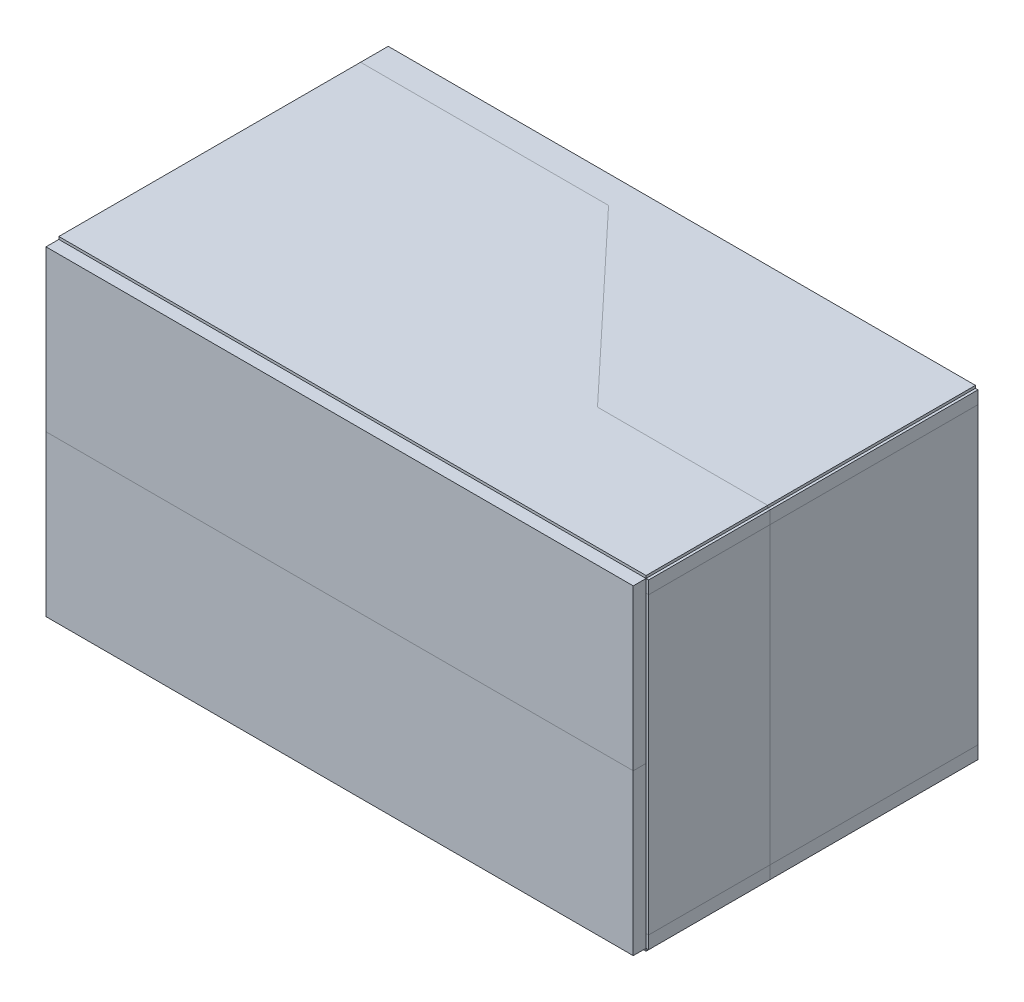
from build123d import *

# Parameters (mm, degrees)
SKETCH_1_W          = 229
SKETCH_1_H          = 124.895981316
EXTRUDE_1_DEPTH     = 7.860636733
SKETCH_2_W          = 229
SKETCH_2_H          = 5
CUT_EXTRUDE_1_DEPTH = 7.860636733
SKETCH_4_W          = 229
SKETCH_4_H          = 5
CUT_EXTRUDE_2_DEPTH = 7.860636733
SKETCH_5_W          = 5
SKETCH_5_H          = 114.895981316
CUT_EXTRUDE_3_DEPTH = 7.860636733
SKETCH_6_W          = 229
SKETCH_6_H          = 128.442125646
EXTRUDE_3_DEPTH     = 5
SKETCH_7_W          = 5
SKETCH_7_H          = 114.895981316
EXTRUDE_4_DEPTH     = 120.581488912
SKETCH_8_W          = 229
SKETCH_8_H          = 128.442125646
EXTRUDE_5_DEPTH     = 5
SKETCH_9_W          = 229
SKETCH_9_H          = 62.45
EXTRUDE_6_DEPTH     = 5
SKETCH_10_W         = 229
SKETCH_10_H         = 62.445981316
EXTRUDE_7_DEPTH     = 5
SKETCH_11_W         = 128.442125646
SKETCH_11_H         = 114.895981316
EXTRUDE_8_DEPTH     = 5
EXTRUDE_9_DEPTH     = 1
EXTRUDE_10_DEPTH    = 1
SKETCH_14_W         = 47.406489423
SKETCH_14_H         = 5
EXTRUDE_11_DEPTH    = 1
SKETCH_15_W         = 81.035636223
SKETCH_15_H         = 5
EXTRUDE_12_DEPTH    = 1
SKETCH_16_W         = 47.406489423
SKETCH_16_H         = 114.895981316
EXTRUDE_13_DEPTH    = 1
SKETCH_17_W         = 81.035636223
SKETCH_17_H         = 114.895981316
EXTRUDE_14_DEPTH    = 1
SKETCH_18_W         = 53.126978482
SKETCH_18_H         = 23.043618666
EXTRUDE_15_DEPTH    = 20
SKETCH_18_W_2       = 40.390239825
EXTRUDE_15_2_DEPTH  = 20
SKETCH_18_W_3       = 34.059537502
EXTRUDE_15_3_DEPTH  = 20
SKETCH_18_W_4       = 41.132707469
EXTRUDE_15_4_DEPTH  = 20
SKETCH_18_W_5       = 34.565287386
SKETCH_18_H_2       = 26.831202025
EXTRUDE_15_5_DEPTH  = 20
SKETCH_18_W_6       = 31.183641042
EXTRUDE_15_6_DEPTH  = 20
SKETCH_18_W_7       = 48.408890379
SKETCH_18_H_3       = 42.023668641
EXTRUDE_15_7_DEPTH  = 20
SKETCH_18_W_8       = 10.097559957
SKETCH_18_H_4       = 12.02797583
EXTRUDE_15_8_DEPTH  = 20
SKETCH_18_W_9       = 56.72452799
SKETCH_18_H_5       = 25.837874006
EXTRUDE_15_9_DEPTH  = 20
SKETCH_18_W_10      = 70.946201934
SKETCH_18_H_6       = 24.501432247
EXTRUDE_15_10_DEPTH = 20
SKETCH_18_W_11      = 64.297697957
SKETCH_18_H_7       = 26.728835178
EXTRUDE_15_11_DEPTH = 20
SKETCH_18_W_12      = 75.583206143
SKETCH_18_H_8       = 13.809898175
EXTRUDE_15_12_DEPTH = 20
SKETCH_18_W_13      = 64.000710899
SKETCH_18_H_9       = 34.302005145
EXTRUDE_15_13_DEPTH = 20
SKETCH_18_W_14      = 22.868003431
SKETCH_18_H_10      = 13.661404647
EXTRUDE_15_14_DEPTH = 20
SKETCH_18_W_15      = 24.204445189
SKETCH_18_H_11      = 11.582495244
EXTRUDE_15_15_DEPTH = 20
SKETCH_19_W         = 41.559774858
SKETCH_19_H         = 32.537902024
EXTRUDE_16_DEPTH    = 20
SKETCH_19_W_2       = 56.053931213
SKETCH_19_H_2       = 25.586622955
EXTRUDE_16_2_DEPTH  = 20
SKETCH_19_W_3       = 20.705937651
SKETCH_19_H_3       = 41.559774857
EXTRUDE_16_3_DEPTH  = 20
SKETCH_19_W_4       = 47.52357196
SKETCH_19_H_4       = 34.164797125
EXTRUDE_16_4_DEPTH  = 20
SKETCH_19_W_5       = 66.702699149
SKETCH_19_H_5       = 32.833701134
EXTRUDE_16_5_DEPTH  = 20
SKETCH_19_W_6       = 41.116076194
SKETCH_19_H_6       = 47.179957935
EXTRUDE_16_6_DEPTH  = 20
SKETCH_19_W_7       = 56.941328542
SKETCH_19_H_7       = 53.983337449
EXTRUDE_16_7_DEPTH  = 20
SKETCH_19_W_8       = 68.62539336
SKETCH_19_H_8       = 26.962014566
EXTRUDE_16_8_DEPTH  = 20
SKETCH_20_W         = 45.290526275
SKETCH_20_H         = 45.142032745
EXTRUDE_17_DEPTH    = 30
SKETCH_20_W_2       = 59.545905036
SKETCH_20_H_2       = 52.269722127
EXTRUDE_17_2_DEPTH  = 30
SKETCH_20_W_3       = 54.497125058
SKETCH_20_H_3       = 28.065276937
EXTRUDE_17_3_DEPTH  = 30
SKETCH_20_W_4       = 23.164990488
SKETCH_20_H_4       = 57.466995634
EXTRUDE_17_4_DEPTH  = 30
SKETCH_20_W_5       = 55.833566817
SKETCH_20_H_5       = 37.42036925
EXTRUDE_17_5_DEPTH  = 30
SKETCH_20_W_6       = 53.754657414
SKETCH_20_H_6       = 43.508603929
EXTRUDE_17_6_DEPTH  = 30
SKETCH_20_W_7       = 19.898132855
SKETCH_20_H_7       = 64.297697957
EXTRUDE_17_7_DEPTH  = 30
SKETCH_20_W_8       = 23.758964603
SKETCH_20_H_8       = 62.664269141
EXTRUDE_17_8_DEPTH  = 30
SKETCH_20_W_9       = 29.550212225
SKETCH_20_H_9       = 31.33213457
EXTRUDE_17_9_DEPTH  = 30
SKETCH_21_W         = 24.501432247
SKETCH_21_H         = 25.837874006
EXTRUDE_18_DEPTH    = 30
SKETCH_21_W_2       = 35.638446905
SKETCH_21_H_2       = 33.559537501
EXTRUDE_18_2_DEPTH  = 30
SKETCH_21_W_3       = 43.211616871
SKETCH_21_H_3       = 31.035147513
EXTRUDE_18_3_DEPTH  = 30
SKETCH_21_W_4       = 40.835720412
SKETCH_21_H_4       = 43.063123343
EXTRUDE_18_4_DEPTH  = 30
SKETCH_21_W_5       = 47.07244862
SKETCH_21_H_5       = 20.195119913
EXTRUDE_18_5_DEPTH  = 30
SKETCH_21_W_6       = 38.756811008
SKETCH_21_H_6       = 46.775461563
EXTRUDE_18_6_DEPTH  = 30
SKETCH_21_W_7       = 55.982060345
SKETCH_21_H_7       = 32.520082801
EXTRUDE_18_7_DEPTH  = 30


with BuildPart() as part:
    # 스케치1 → 보스-돌출1 (new body)
    with BuildSketch(Plane.XY):
        with Locations((165.5, 12.447990658)):
            Rectangle(SKETCH_1_W, SKETCH_1_H)
    extrude(amount=EXTRUDE_1_DEPTH)

    # 스케치2 → 컷-돌출1 (cut)
    with BuildSketch(Plane.XY.offset(7.860636733)):
        with Locations((165.5, 72.395981316)):
            Rectangle(SKETCH_2_W, SKETCH_2_H)
    extrude(amount=-CUT_EXTRUDE_1_DEPTH, mode=Mode.SUBTRACT)

    # 스케치4 → 컷-돌출2 (cut)
    with BuildSketch(Plane.XY.offset(7.860636733)):
        with Locations((165.5, -47.5)):
            Rectangle(SKETCH_4_W, SKETCH_4_H)
    extrude(amount=-CUT_EXTRUDE_2_DEPTH, mode=Mode.SUBTRACT)

    # 스케치5 → 컷-돌출3 (cut)
    with BuildSketch(Plane.XY.offset(7.860636733)):
        with Locations((277.5, 12.447990658)):
            Rectangle(SKETCH_5_W, SKETCH_5_H)
    extrude(amount=-CUT_EXTRUDE_3_DEPTH, mode=Mode.SUBTRACT)


with BuildPart() as body_2:
    # 스케치6 → 보스-돌출3 (new body)
    with BuildSketch(Plane(origin=(0, 69.895981316, 0), x_dir=(1, 0, 0), z_dir=(0, 1, 0))):
        with Locations((165.5, -64.221062823)):
            Rectangle(SKETCH_6_W, SKETCH_6_H)
    extrude(amount=EXTRUDE_3_DEPTH)


with BuildPart() as body_3:
    # 스케치7 → 보스-돌출4 (new body)
    with BuildSketch(Plane.XY.offset(7.860636733)):
        with Locations((53.5, 12.447990658)):
            Rectangle(SKETCH_7_W, SKETCH_7_H)
    extrude(amount=EXTRUDE_4_DEPTH)


with BuildPart() as body_4:
    # 스케치8 → 보스-돌출5 (new body)
    with BuildSketch(Plane.XZ.offset(45)):
        with Locations((165.5, 64.221062823)):
            Rectangle(SKETCH_8_W, SKETCH_8_H)
    extrude(amount=EXTRUDE_5_DEPTH)


with BuildPart() as body_5:
    # 스케치9 → 보스-돌출6 (new body)
    with BuildSketch(Plane.XY.offset(128.442125646)):
        with Locations((165.5, 43.670981316)):
            Rectangle(SKETCH_9_W, SKETCH_9_H)
    extrude(amount=EXTRUDE_6_DEPTH)


with BuildPart() as body_6:
    # 스케치10 → 보스-돌출7 (new body)
    with BuildSketch(Plane.XY.offset(128.442125646)):
        with Locations((165.5, -18.777009342)):
            Rectangle(SKETCH_10_W, SKETCH_10_H)
    extrude(amount=EXTRUDE_7_DEPTH)


with BuildPart() as body_7:
    # 스케치11 → 보스-돌출8 (new body)
    with BuildSketch(Plane(origin=(275, 0, 0), x_dir=(0, 0, -1), z_dir=(1, 0, 0))):
        with Locations((-64.221062823, 12.447990658)):
            Rectangle(SKETCH_11_W, SKETCH_11_H)
    extrude(amount=EXTRUDE_8_DEPTH)


with BuildPart() as body_8:
    # 스케치12 → 보스-돌출9 (new body)
    with BuildSketch(Plane.XZ.offset(50)):
        Polygon((51, 10.771238208), (147.705868367, 10.771238208), (213.658520424, 81.035636223), (280, 81.035636223), (280, 0), (51, 0), align=None)
    extrude(amount=EXTRUDE_9_DEPTH)


with BuildPart() as body_9:
    # 스케치13 → 보스-돌출10 (new body)
    with BuildSketch(Plane.XZ.offset(50)):
        Polygon((51, 128.442125646), (51, 10.771238208), (147.705868367, 10.771238208), (213.658520424, 81.035636223), (280, 81.035636223), (280, 128.442125646), align=None)
    extrude(amount=EXTRUDE_10_DEPTH)


with BuildPart() as body_10:
    # 스케치14 → 보스-돌출11 (new body)
    with BuildSketch(Plane(origin=(280, 0, 0), x_dir=(0, 0, -1), z_dir=(1, 0, 0))):
        with Locations((-104.738880935, -47.5)):
            Rectangle(SKETCH_14_W, SKETCH_14_H)
    extrude(amount=EXTRUDE_11_DEPTH)


with BuildPart() as body_11:
    # 스케치15 → 보스-돌출12 (new body)
    with BuildSketch(Plane(origin=(280, 0, 0), x_dir=(0, 0, -1), z_dir=(1, 0, 0))):
        with Locations((-40.517818112, -47.5)):
            Rectangle(SKETCH_15_W, SKETCH_15_H)
    extrude(amount=EXTRUDE_12_DEPTH)


with BuildPart() as body_12:
    # 스케치16 → 보스-돌출13 (new body)
    with BuildSketch(Plane(origin=(280, 0, 0), x_dir=(0, 0, -1), z_dir=(1, 0, 0))):
        with Locations((-104.738880935, 12.447990658)):
            Rectangle(SKETCH_16_W, SKETCH_16_H)
    extrude(amount=EXTRUDE_13_DEPTH)


with BuildPart() as body_13:
    # 스케치17 → 보스-돌출14 (new body)
    with BuildSketch(Plane(origin=(280, 0, 0), x_dir=(0, 0, -1), z_dir=(1, 0, 0))):
        with Locations((-40.517818112, 12.447990658)):
            Rectangle(SKETCH_17_W, SKETCH_17_H)
    extrude(amount=EXTRUDE_14_DEPTH)


with BuildPart() as body_14:
    # 대칭 복사2: mirrored copy
    add(body_8.part.mirror(Plane.ZX.offset(12.445981316)))


with BuildPart() as body_15:
    # Mirror 2 2: mirrored copy
    add(body_9.part.mirror(Plane.ZX.offset(12.445981316)))


with BuildPart() as body_16:
    # Mirror 2 3: mirrored copy
    add(body_10.part.mirror(Plane.ZX.offset(12.445981316)))


with BuildPart() as body_17:
    # Mirror 2 4: mirrored copy
    add(body_11.part.mirror(Plane.ZX.offset(12.445981316)))


with BuildPart() as body_18:
    # 스케치18 → 보스-돌출15 (new body)
    with BuildSketch(Plane.XY.offset(7.860636733)):
        with Locations((82.563489241, 58.374171983)):
            Rectangle(SKETCH_18_W, SKETCH_18_H)
    extrude(amount=EXTRUDE_15_DEPTH)


with BuildPart() as body_19:
    # 스케치18 → Extrude 15 2 (new body)
    with BuildSketch(Plane.XY.offset(7.860636733)):
        with Locations((138.23171012, 58.374171983)):
            Rectangle(SKETCH_18_W_2, SKETCH_18_H)
    extrude(amount=EXTRUDE_15_2_DEPTH)


with BuildPart() as body_20:
    # 스케치18 → Extrude 15 3 (new body)
    with BuildSketch(Plane.XY.offset(7.860636733)):
        with Locations((182.529768751, 58.374171983)):
            Rectangle(SKETCH_18_W_3, SKETCH_18_H)
    extrude(amount=EXTRUDE_15_3_DEPTH)


with BuildPart() as body_21:
    # 스케치18 → Extrude 15 4 (new body)
    with BuildSketch(Plane.XY.offset(7.860636733)):
        with Locations((227.402074146, 58.374171983)):
            Rectangle(SKETCH_18_W_4, SKETCH_18_H)
    extrude(amount=EXTRUDE_15_4_DEPTH)


with BuildPart() as body_22:
    # 스케치18 → Extrude 15 5 (new body)
    with BuildSketch(Plane.XY.offset(7.860636733)):
        with Locations((73.282643693, 25.863591671)):
            Rectangle(SKETCH_18_W_5, SKETCH_18_H_2)
    extrude(amount=EXTRUDE_15_5_DEPTH)


with BuildPart() as body_23:
    # 스케치18 → Extrude 15 6 (new body)
    with BuildSketch(Plane.XY.offset(7.860636733)):
        with Locations((111.354381413, 25.863591671)):
            Rectangle(SKETCH_18_W_6, SKETCH_18_H_2)
    extrude(amount=EXTRUDE_15_6_DEPTH)


with BuildPart() as body_24:
    # 스케치18 → Extrude 15 7 (new body)
    with BuildSketch(Plane.XY.offset(7.860636733)):
        with Locations((160.06025885, 18.267358363)):
            Rectangle(SKETCH_18_W_7, SKETCH_18_H_3)
    extrude(amount=EXTRUDE_15_7_DEPTH)


with BuildPart() as body_25:
    # 스케치18 → Extrude 15 8 (new body)
    with BuildSketch(Plane.XY.offset(7.860636733)):
        with Locations((194.510757524, 33.265204768)):
            Rectangle(SKETCH_18_W_8, SKETCH_18_H_4)
    extrude(amount=EXTRUDE_15_8_DEPTH)


with BuildPart() as body_26:
    # 스케치18 → Extrude 15 9 (new body)
    with BuildSketch(Plane.XY.offset(7.860636733)):
        with Locations((235.197984406, 26.36025568)):
            Rectangle(SKETCH_18_W_9, SKETCH_18_H_5)
    extrude(amount=EXTRUDE_15_9_DEPTH)


with BuildPart() as body_27:
    # 스케치18 → Extrude 15 10 (new body)
    with BuildSketch(Plane.XY.offset(7.860636733)):
        with Locations((91.473100967, -8.312983287)):
            Rectangle(SKETCH_18_W_10, SKETCH_18_H_6)
    extrude(amount=EXTRUDE_15_10_DEPTH)


with BuildPart() as body_28:
    # 스케치18 → Extrude 15 11 (new body)
    with BuildSketch(Plane.XY.offset(7.860636733)):
        with Locations((162.361908546, -18.484790008)):
            Rectangle(SKETCH_18_W_11, SKETCH_18_H_7)
    extrude(amount=EXTRUDE_15_11_DEPTH)


with BuildPart() as body_29:
    # 스케치18 → Extrude 15 12 (new body)
    with BuildSketch(Plane.XY.offset(7.860636733)):
        with Locations((225.76864533, 4.160473129)):
            Rectangle(SKETCH_18_W_12, SKETCH_18_H_8)
    extrude(amount=EXTRUDE_15_12_DEPTH)


with BuildPart() as body_30:
    # 스케치18 → Extrude 15 13 (new body)
    with BuildSketch(Plane.XY.offset(7.860636733)):
        with Locations((231.559892952, -24.350284395)):
            Rectangle(SKETCH_18_W_13, SKETCH_18_H_9)
    extrude(amount=EXTRUDE_15_13_DEPTH)


with BuildPart() as body_31:
    # 스케치18 → Extrude 15 14 (new body)
    with BuildSketch(Plane.XY.offset(7.860636733)):
        with Locations((70.073180416, -34.670584644)):
            Rectangle(SKETCH_18_W_14, SKETCH_18_H_10)
    extrude(amount=EXTRUDE_15_14_DEPTH)


with BuildPart() as body_32:
    # 스케치18 → Extrude 15 15 (new body)
    with BuildSketch(Plane.XY.offset(7.860636733)):
        with Locations((109.349718775, -35.710039345)):
            Rectangle(SKETCH_18_W_15, SKETCH_18_H_11)
    extrude(amount=EXTRUDE_15_15_DEPTH)


with BuildPart() as body_33:
    # 스케치19 → 보스-돌출16 (new body)
    with BuildSketch(Plane.XY.offset(27.860636733)):
        with Locations((80.503365876, 50.388632092)):
            Rectangle(SKETCH_19_W, SKETCH_19_H)
    extrude(amount=EXTRUDE_16_DEPTH)


with BuildPart() as body_34:
    # 스케치19 → Extrude 16 2 (new body)
    with BuildSketch(Plane.XY.offset(27.860636733)):
        with Locations((135.817799317, 52.089476971)):
            Rectangle(SKETCH_19_W_2, SKETCH_19_H_2)
    extrude(amount=EXTRUDE_16_2_DEPTH)


with BuildPart() as body_35:
    # 스케치19 → Extrude 16 3 (new body)
    with BuildSketch(Plane.XY.offset(27.860636733)):
        with Locations((184.254903466, 42.919704583)):
            Rectangle(SKETCH_19_W_3, SKETCH_19_H_3)
    extrude(amount=EXTRUDE_16_3_DEPTH)


with BuildPart() as body_36:
    # 스케치19 → Extrude 16 4 (new body)
    with BuildSketch(Plane.XY.offset(27.860636733)):
        with Locations((230.597506391, 49.575184542)):
            Rectangle(SKETCH_19_W_4, SKETCH_19_H_4)
    extrude(amount=EXTRUDE_16_4_DEPTH)


with BuildPart() as body_37:
    # 스케치19 → Extrude 16 5 (new body)
    with BuildSketch(Plane.XY.offset(27.860636733)):
        with Locations((99.730307982, 9.568355008)):
            Rectangle(SKETCH_19_W_5, SKETCH_19_H_5)
    extrude(amount=EXTRUDE_16_5_DEPTH)


with BuildPart() as body_38:
    # 스케치19 → Extrude 16 6 (new body)
    with BuildSketch(Plane.XY.offset(27.860636733)):
        with Locations((169.169148891, -5.295550235)):
            Rectangle(SKETCH_19_W_6, SKETCH_19_H_6)
    extrude(amount=EXTRUDE_16_6_DEPTH)


with BuildPart() as body_39:
    # 스케치19 → Extrude 16 7 (new body)
    with BuildSketch(Plane.XY.offset(27.860636733)):
        with Locations((230.029815631, -5.887148454)):
            Rectangle(SKETCH_19_W_7, SKETCH_19_H_7)
    extrude(amount=EXTRUDE_16_7_DEPTH)


with BuildPart() as body_40:
    # 스케치19 → Extrude 16 8 (new body)
    with BuildSketch(Plane.XY.offset(27.860636733)):
        with Locations((98.768960876, -28.020279684)):
            Rectangle(SKETCH_19_W_8, SKETCH_19_H_8)
    extrude(amount=EXTRUDE_16_8_DEPTH)


with BuildPart() as body_41:
    # 스케치20 → 보스-돌출17 (new body)
    with BuildSketch(Plane.XY.offset(47.860636733)):
        with Locations((92.718443553, 33.933425648)):
            Rectangle(SKETCH_20_W, SKETCH_20_H)
    extrude(amount=EXTRUDE_17_DEPTH)


with BuildPart() as body_42:
    # 스케치20 → Extrude 17 2 (new body)
    with BuildSketch(Plane.XY.offset(47.860636733)):
        with Locations((150.779413301, 41.506595615)):
            Rectangle(SKETCH_20_W_2, SKETCH_20_H_2)
    extrude(amount=EXTRUDE_17_2_DEPTH)


with BuildPart() as body_43:
    # 스케치20 → Extrude 17 3 (new body)
    with BuildSketch(Plane.XY.offset(47.860636733)):
        with Locations((213.443682442, 53.60881821)):
            Rectangle(SKETCH_20_W_3, SKETCH_20_H_3)
    extrude(amount=EXTRUDE_17_3_DEPTH)


with BuildPart() as body_44:
    # 스케치20 → Extrude 17 4 (new body)
    with BuildSketch(Plane.XY.offset(47.860636733)):
        with Locations((257.472013721, 38.907958861)):
            Rectangle(SKETCH_20_W_4, SKETCH_20_H_4)
    extrude(amount=EXTRUDE_17_4_DEPTH)


with BuildPart() as body_45:
    # 스케치20 → Extrude 17 5 (new body)
    with BuildSketch(Plane.XY.offset(47.860636733)):
        with Locations((89.525832685, -16.554374134)):
            Rectangle(SKETCH_20_W_5, SKETCH_20_H_5)
    extrude(amount=EXTRUDE_17_5_DEPTH)


with BuildPart() as body_46:
    # 스케치20 → Extrude 17 6 (new body)
    with BuildSketch(Plane.XY.offset(47.860636733)):
        with Locations((149.962698893, -14.846698553)):
            Rectangle(SKETCH_20_W_6, SKETCH_20_H_6)
    extrude(amount=EXTRUDE_17_6_DEPTH)


with BuildPart() as body_47:
    # 스케치20 → Extrude 17 7 (new body)
    with BuildSketch(Plane.XY.offset(47.860636733)):
        with Locations((194.213770467, -3.115709781)):
            Rectangle(SKETCH_20_W_7, SKETCH_20_H_7)
    extrude(amount=EXTRUDE_17_7_DEPTH)


with BuildPart() as body_48:
    # 스케치20 → Extrude 17 8 (new body)
    with BuildSketch(Plane.XY.offset(47.860636733)):
        with Locations((224.060969749, -5.268865947)):
            Rectangle(SKETCH_20_W_8, SKETCH_20_H_8)
    extrude(amount=EXTRUDE_17_8_DEPTH)


with BuildPart() as body_49:
    # 스케치20 → Extrude 17 9 (new body)
    with BuildSketch(Plane.XY.offset(47.860636733)):
        with Locations((257.991741073, -20.934933233)):
            Rectangle(SKETCH_20_W_9, SKETCH_20_H_9)
    extrude(amount=EXTRUDE_17_9_DEPTH)


with BuildPart() as body_50:
    # 스케치21 → 보스-돌출18 (new body)
    with BuildSketch(Plane.XY.offset(77.860636733)):
        with Locations((70.889894824, 54.722519675)):
            Rectangle(SKETCH_21_W, SKETCH_21_H)
    extrude(amount=EXTRUDE_18_DEPTH)


with BuildPart() as body_51:
    # 스케치21 → Extrude 18 2 (new body)
    with BuildSketch(Plane.XY.offset(77.860636733)):
        with Locations((77.646350383, 12.698851034)):
            Rectangle(SKETCH_21_W_2, SKETCH_21_H_2)
    extrude(amount=EXTRUDE_18_2_DEPTH)


with BuildPart() as body_52:
    # 스케치21 → Extrude 18 3 (new body)
    with BuildSketch(Plane.XY.offset(77.860636733)):
        with Locations((115.289459926, 48.411544703)):
            Rectangle(SKETCH_21_W_3, SKETCH_21_H_3)
    extrude(amount=EXTRUDE_18_3_DEPTH)


with BuildPart() as body_53:
    # 스케치21 → Extrude 18 4 (new body)
    with BuildSketch(Plane.XY.offset(77.860636733)):
        with Locations((130.287306331, 1.710329904)):
            Rectangle(SKETCH_21_W_4, SKETCH_21_H_4)
    extrude(amount=EXTRUDE_18_4_DEPTH)


with BuildPart() as body_54:
    # 스케치21 → Extrude 18 5 (new body)
    with BuildSketch(Plane.XY.offset(77.860636733)):
        with Locations((82.17540301, -25.166998803)):
            Rectangle(SKETCH_21_W_5, SKETCH_21_H_5)
    extrude(amount=EXTRUDE_18_5_DEPTH)


with BuildPart() as body_55:
    # 스케치21 → Extrude 18 6 (new body)
    with BuildSketch(Plane.XY.offset(77.860636733)):
        with Locations((174.538377904, 36.086581815)):
            Rectangle(SKETCH_21_W_6, SKETCH_21_H_6)
    extrude(amount=EXTRUDE_18_6_DEPTH)


with BuildPart() as body_56:
    # 스케치21 → Extrude 18 7 (new body)
    with BuildSketch(Plane.XY.offset(77.860636733)):
        with Locations((234.678257056, 45.738661185)):
            Rectangle(SKETCH_21_W_7, SKETCH_21_H_7)
    extrude(amount=EXTRUDE_18_7_DEPTH)


solid = Compound([part.part, body_2.part, body_3.part, body_4.part, body_5.part, body_6.part, body_7.part, body_8.part, body_9.part, body_10.part, body_11.part, body_12.part, body_13.part, body_14.part, body_15.part, body_16.part, body_17.part, body_18.part, body_19.part, body_20.part, body_21.part, body_22.part, body_23.part, body_24.part, body_25.part, body_26.part, body_27.part, body_28.part, body_29.part, body_30.part, body_31.part, body_32.part, body_33.part, body_34.part, body_35.part, body_36.part, body_37.part, body_38.part, body_39.part, body_40.part, body_41.part, body_42.part, body_43.part, body_44.part, body_45.part, body_46.part, body_47.part, body_48.part, body_49.part, body_50.part, body_51.part, body_52.part, body_53.part, body_54.part, body_55.part, body_56.part])
